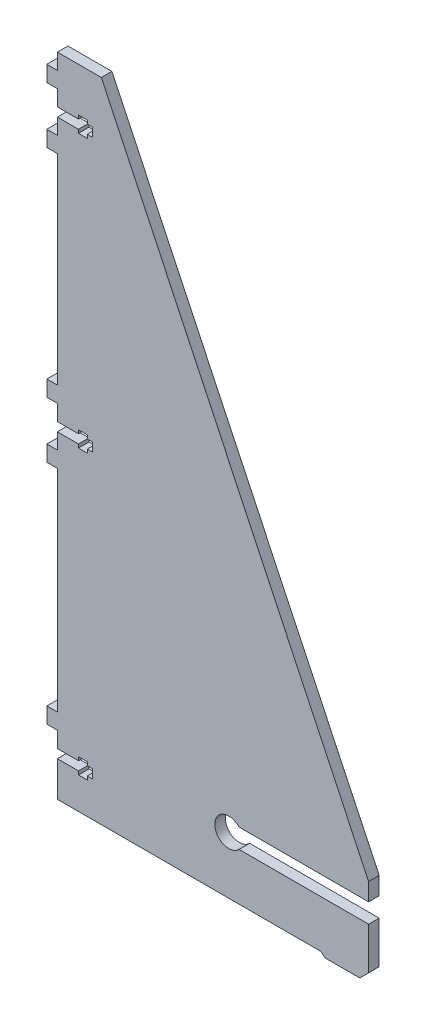
from build123d import *

# Parameters (mm, degrees)
DODANIE_WYCI_GNI_CIE1_DEPTH = 6
SFAZOWANIE1_SIZE            = 5
WYTNIJ_WYCI_GNI_CIE1_REACH  = 258.105
WYTNIJ_WYCI_GNI_CIE2_REACH  = 258.105
SZKIC5_W                    = 6
SZKIC5_H                    = 9
DODANIE_WYCI_GNI_CIE3_DEPTH = 6
WYTNIJ_WYCI_GNI_CIE3_REACH  = 258.105


with BuildPart() as part:
    # Szkic1 → Dodanie-wyciągnięcie1 (new body)
    with BuildSketch(Plane.XY):
        Polygon((0, -185), (0, 185), (25, 185), (177, -135), (177, -185), align=None)
    extrude(amount=DODANIE_WYCI_GNI_CIE1_DEPTH)

    # Sfazowanie1
    sfazowanie1_edges = [part.edges().sort_by_distance(p)[0] for p in [
        (177, -185, 3),
    ]]
    chamfer(sfazowanie1_edges, length=SFAZOWANIE1_SIZE)

    # Szkic2 → Wytnij-wyciągnięcie1 (cut, up to next)
    with BuildSketch(Plane.XY.offset(6), mode=Mode.PRIVATE) as wytnij_wyci_gni_cie1_sk1:
        Polygon((0, -183), (150, -183), (152, -185), (0, -185), align=None)
    wytnij_wyci_gni_cie1_tool1 = extrude(wytnij_wyci_gni_cie1_sk1.sketch, amount=-WYTNIJ_WYCI_GNI_CIE1_REACH, mode=Mode.PRIVATE) & part.part
    add(wytnij_wyci_gni_cie1_tool1.solids().sort_by_distance((75.501104, -184.002208, 6))[0], mode=Mode.SUBTRACT)

    # Szkic3 → Wytnij-wyciągnięcie2 (cut, up to next)
    with BuildSketch(Plane.XY.offset(6), mode=Mode.PRIVATE) as wytnij_wyci_gni_cie2_sk1:
        with BuildLine():
            Line((177, -145), (103.309475019, -145))
            ThreePointArc((103.309475019, -145), (89.5, -150.5), (103.309475019, -156))
            Line((103.309475019, -156), (177, -156))
            Line((177, -156), (177, -145))
        make_face()
    wytnij_wyci_gni_cie2_tool1 = extrude(wytnij_wyci_gni_cie2_sk1.sketch, amount=-WYTNIJ_WYCI_GNI_CIE2_REACH, mode=Mode.PRIVATE) & part.part
    add(wytnij_wyci_gni_cie2_tool1.solids().sort_by_distance((132.134709, -150.5, 6))[0], mode=Mode.SUBTRACT)

    # Szkic5 → Dodanie-wyciągnięcie3 (add)
    with BuildSketch(Plane.ZY):
        with Locations((3, 171.5)):
            Rectangle(SZKIC5_W, SZKIC5_H)
        with Locations((3, 139.5)):
            Rectangle(SZKIC5_W, SZKIC5_H)
        with Locations((3, -144.5)):
            Rectangle(SZKIC5_W, SZKIC5_H)
        with Locations((3, -15.5)):
            Rectangle(SZKIC5_W, SZKIC5_H)
        with Locations((3, 16.5)):
            Rectangle(SZKIC5_W, SZKIC5_H)
    extrude(amount=DODANIE_WYCI_GNI_CIE3_DEPTH)

    # Szkic6 → Wytnij-wyciągnięcie3 (cut, up to next)
    with BuildSketch(Plane.XY.offset(6), mode=Mode.PRIVATE) as wytnij_wyci_gni_cie3_sk1:
        Polygon((12, -156), (12, -158), (0, -158), (0, -160.5), (0, -163), (12, -163), (12, -165), (17, -165), (17, -163), (20, -163), (20, -158), (17, -158), (17, -156), align=None)
    wytnij_wyci_gni_cie3_tool1 = extrude(wytnij_wyci_gni_cie3_sk1.sketch, amount=-WYTNIJ_WYCI_GNI_CIE3_REACH, mode=Mode.PRIVATE) & part.part
    # Szkic6 → Wytnij-wyciągnięcie3 (cut, up to next)
    with BuildSketch(Plane.XY.offset(6), mode=Mode.PRIVATE) as wytnij_wyci_gni_cie3_sk2:
        Polygon((12, 3), (0, 3), (0, -2), (12, -2), (12, -4), (17, -4), (17, -2), (20, -2), (20, 3), (17, 3), (17, 5), (12, 5), align=None)
    wytnij_wyci_gni_cie3_tool2 = extrude(wytnij_wyci_gni_cie3_sk2.sketch, amount=-WYTNIJ_WYCI_GNI_CIE3_REACH, mode=Mode.PRIVATE) & part.part
    # Szkic6 → Wytnij-wyciągnięcie3 (cut, up to next)
    with BuildSketch(Plane.XY.offset(6), mode=Mode.PRIVATE) as wytnij_wyci_gni_cie3_sk3:
        Polygon((12, 158), (0, 158), (0, 153), (12, 153), (12, 151), (17, 151), (17, 153), (20, 153), (20, 158), (17, 158), (17, 160), (12, 160), align=None)
    wytnij_wyci_gni_cie3_tool3 = extrude(wytnij_wyci_gni_cie3_sk3.sketch, amount=-WYTNIJ_WYCI_GNI_CIE3_REACH, mode=Mode.PRIVATE) & part.part
    add(wytnij_wyci_gni_cie3_tool1.solids().sort_by_distance((10.75, -160.5, 6))[0], mode=Mode.SUBTRACT)
    add(wytnij_wyci_gni_cie3_tool2.solids().sort_by_distance((10.75, 0.5, 6))[0], mode=Mode.SUBTRACT)
    add(wytnij_wyci_gni_cie3_tool3.solids().sort_by_distance((10.75, 155.5, 6))[0], mode=Mode.SUBTRACT)


solid = part.part
